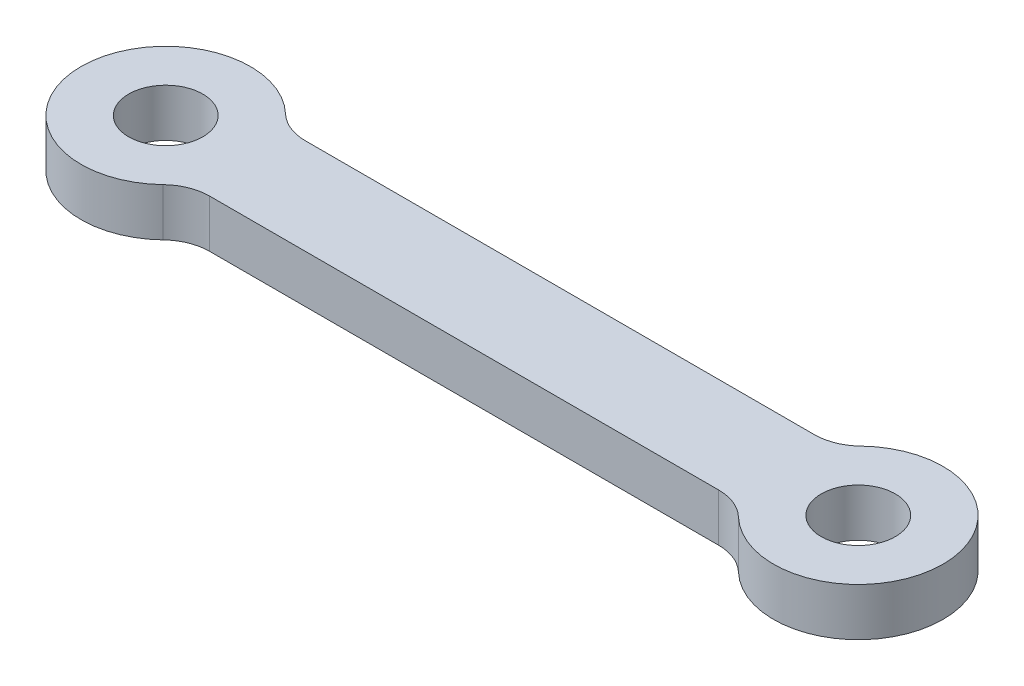
from build123d import *

# Parameters (mm, degrees)
SKETCH_1_R      = 7.744401216
EXTRUDE_1_DEPTH = 10
FILLET_1_R      = 10


with BuildPart() as part:
    # 草图1 → 凸台-拉伸1 (new body)
    with BuildSketch(Plane(origin=(0, 0, 0), x_dir=(1, 0, 0), z_dir=(0, 1, 0))):
        with BuildLine():
            ThreePointArc((14.606255334, 10), (-17.701488493, 0), (14.606255334, -10))
            Line((14.606255334, -10), (130.028894825, -10))
            ThreePointArc((130.028894825, -10), (162.336638652, 0), (130.028894825, 10))
            Line((130.028894825, 10), (14.606255334, 10))
        make_face()
        with Locations(Location((0, 0, 0), (0, 0, 270))):
            Circle(SKETCH_1_R, mode=Mode.SUBTRACT)
        with Locations(Location((144.635150159, 0, 0), (0, 0, 270))):
            Circle(SKETCH_1_R, mode=Mode.SUBTRACT)
    extrude(amount=EXTRUDE_1_DEPTH)

    # 圆角1
    fillet_1_edges = [part.edges().sort_by_distance(p)[0] for p in [
        (130.028894825, 5, -10),
        (130.028894825, 5, 10),
        (14.606255334, 5, 10),
        (14.606255334, 5, -10),
    ]]
    fillet(fillet_1_edges, radius=FILLET_1_R)


solid = part.part
